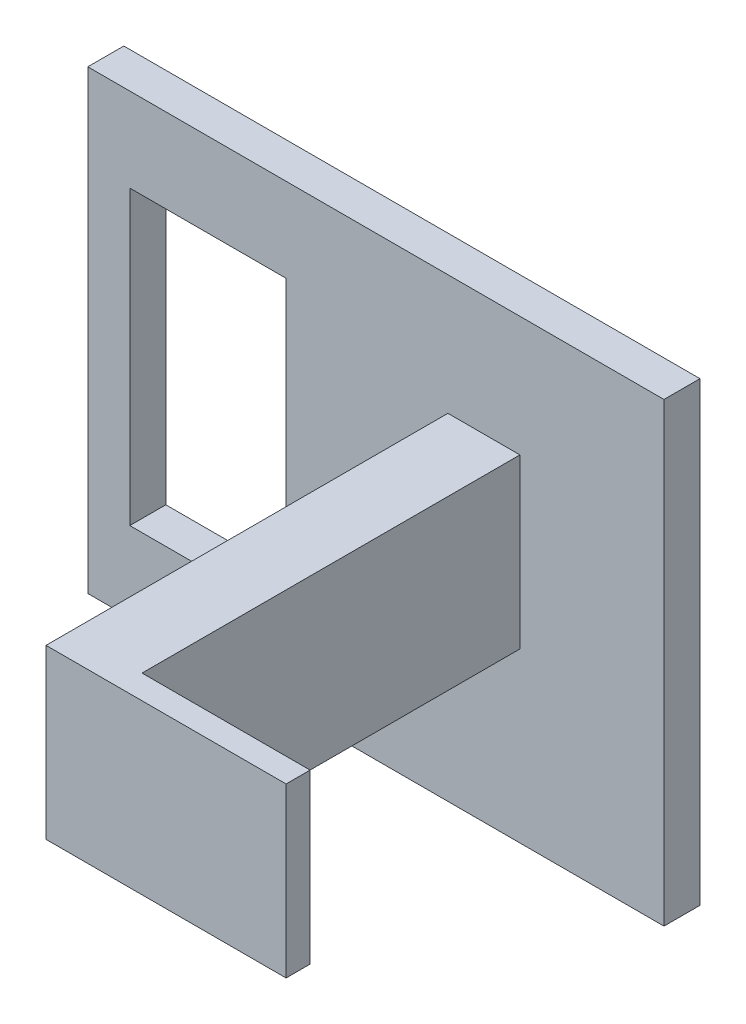
from build123d import *

# Parameters (mm, degrees)
SERVO_SHELF_START           = -36.480025
SKETCH1_W                   = 48
SKETCH1_H                   = 38
SKETCH1_W_2                 = 13
SKETCH1_H_2                 = 24.35
SERVO_SHELF_DEPTH           = 3
OUTBOARD_RISER_START        = -34.480025
SKETCH2_W                   = 6
SKETCH2_H                   = 14
OUTBOARD_RISER_DEPTH        = 33.480025
PLATE_ATTACHMENT_FOOT_START = -2
SKETCH3_W                   = 20
SKETCH3_H                   = 14
PLATE_ATTACHMENT_FOOT_DEPTH = 2


with BuildPart() as part:
    # Sketch1 → Servo_Shelf (new body)
    with BuildSketch(Plane.XY.offset(SERVO_SHELF_START)):
        with Locations((-46, 19)):
            Rectangle(SKETCH1_W, SKETCH1_H)
        with Locations((-60, 18.825)):
            Rectangle(SKETCH1_W_2, SKETCH1_H_2, mode=Mode.SUBTRACT)
    extrude(amount=SERVO_SHELF_DEPTH)

    # Sketch2 → Outboard_Riser (add)
    with BuildSketch(Plane.XY.offset(OUTBOARD_RISER_START)):
        with Locations((-37, 21)):
            Rectangle(SKETCH2_W, SKETCH2_H)
    extrude(amount=OUTBOARD_RISER_DEPTH)

    # Sketch3 → Plate_Attachment_Foot (add)
    with BuildSketch(Plane.XY.offset(PLATE_ATTACHMENT_FOOT_START)):
        with Locations((-30, 21)):
            Rectangle(SKETCH3_W, SKETCH3_H)
    extrude(amount=PLATE_ATTACHMENT_FOOT_DEPTH)


solid = part.part
